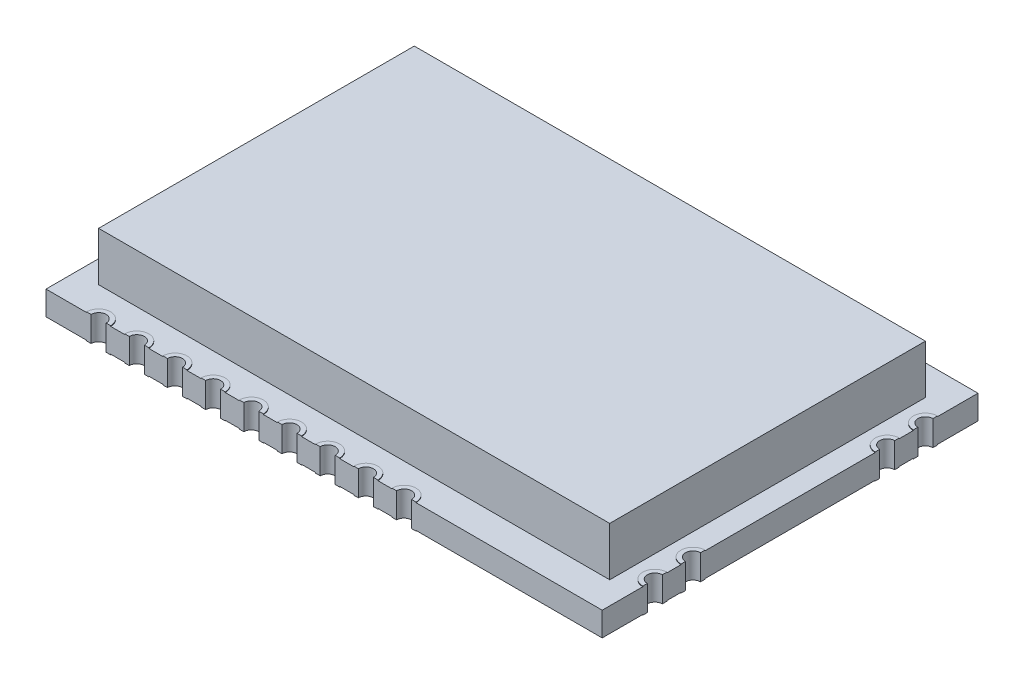
from build123d import *

# Parameters (mm, degrees)
BOSS_EXTRUDE1_DEPTH = 1.6
BOSS_EXTRUDE2_DEPTH = 0.04
BOSS_EXTRUDE3_START = 0.04
BOSS_EXTRUDE3_DEPTH = 0.04
SKETCH11_W          = 34
SKETCH11_H          = 21
BOSS_EXTRUDE5_DEPTH = 3.25


with BuildPart() as part:
    # Sketch1 → Boss-Extrude1 (new body)
    with BuildSketch(Plane(origin=(0, 0, 0), x_dir=(1, 0, 0), z_dir=(0, 1, 0))):
        with BuildLine():
            Line((18.5, 9.5), (18.5, 12.5))
            Line((18.5, 12.5), (5.82, 12.5))
            ThreePointArc((5.82, 12.5), (5.32, 12), (4.82, 12.5))
            Line((4.82, 12.5), (3.28, 12.5))
            ThreePointArc((3.28, 12.5), (2.78, 12), (2.28, 12.5))
            Line((2.28, 12.5), (0.74, 12.5))
            ThreePointArc((0.74, 12.5), (0.24, 12), (-0.26, 12.5))
            Line((-0.26, 12.5), (-1.8, 12.5))
            ThreePointArc((-1.8, 12.5), (-2.3, 12), (-2.8, 12.5))
            Line((-2.8, 12.5), (-4.34, 12.5))
            ThreePointArc((-4.34, 12.5), (-4.84, 12), (-5.34, 12.5))
            Line((-5.34, 12.5), (-6.88, 12.5))
            ThreePointArc((-6.88, 12.5), (-7.38, 12), (-7.88, 12.5))
            Line((-7.88, 12.5), (-9.42, 12.5))
            ThreePointArc((-9.42, 12.5), (-9.92, 12), (-10.42, 12.5))
            Line((-10.42, 12.5), (-11.96, 12.5))
            ThreePointArc((-11.96, 12.5), (-12.46, 12), (-12.96, 12.5))
            Line((-12.96, 12.5), (-14.5, 12.5))
            ThreePointArc((-14.5, 12.5), (-15, 12), (-15.5, 12.5))
            Line((-15.5, 12.5), (-18.5, 12.5))
            Line((-18.5, 12.5), (-18.5, -12.5))
            Line((-18.5, -12.5), (-15.5, -12.5))
            ThreePointArc((-15.5, -12.5), (-15, -12), (-14.5, -12.5))
            Line((-14.5, -12.5), (-12.96, -12.5))
            ThreePointArc((-12.96, -12.5), (-12.46, -12), (-11.96, -12.5))
            Line((-11.96, -12.5), (-10.42, -12.5))
            ThreePointArc((-10.42, -12.5), (-9.92, -12), (-9.42, -12.5))
            Line((-9.42, -12.5), (-7.88, -12.5))
            ThreePointArc((-7.88, -12.5), (-7.38, -12), (-6.88, -12.5))
            Line((-6.88, -12.5), (-5.34, -12.5))
            ThreePointArc((-5.34, -12.5), (-4.84, -12), (-4.34, -12.5))
            Line((-4.34, -12.5), (-2.8, -12.5))
            ThreePointArc((-2.8, -12.5), (-2.3, -12), (-1.8, -12.5))
            Line((-1.8, -12.5), (-0.26, -12.5))
            ThreePointArc((-0.26, -12.5), (0.24, -12), (0.74, -12.5))
            Line((0.74, -12.5), (2.28, -12.5))
            ThreePointArc((2.28, -12.5), (2.78, -12), (3.28, -12.5))
            Line((3.28, -12.5), (4.82, -12.5))
            ThreePointArc((4.82, -12.5), (5.32, -12), (5.82, -12.5))
            Line((5.82, -12.5), (18.5, -12.5))
            Line((18.5, -12.5), (18.5, -9.5))
            ThreePointArc((18.5, -9.5), (18, -9), (18.5, -8.5))
            Line((18.5, -8.5), (18.5, -6.96))
            ThreePointArc((18.5, -6.96), (18, -6.46), (18.5, -5.96))
            Line((18.5, -5.96), (18.5, 5.96))
            ThreePointArc((18.5, 5.96), (18, 6.46), (18.5, 6.96))
            Line((18.5, 6.96), (18.5, 8.5))
            ThreePointArc((18.5, 8.5), (18, 9), (18.5, 9.5))
        make_face()
    extrude(amount=BOSS_EXTRUDE1_DEPTH)

    # Sketch2 → Boss-Extrude2 (add)
    with BuildSketch(Plane(origin=(0, 1.6, 0), x_dir=(1, 0, 0), z_dir=(0, 1, 0))):
        with BuildLine():
            Line((-15.5, 12.5), (-15.8, 12.5))
            ThreePointArc((-15.8, 12.5), (-15, 11.7), (-14.2, 12.5))
            Line((-14.2, 12.5), (-14.5, 12.5))
            ThreePointArc((-14.5, 12.5), (-15, 12), (-15.5, 12.5))
        make_face()
        with BuildLine():
            Line((-13.26, 12.5), (-12.96, 12.5))
            ThreePointArc((-12.96, 12.5), (-12.46, 12), (-11.96, 12.5))
            Line((-11.96, 12.5), (-11.66, 12.5))
            ThreePointArc((-11.66, 12.5), (-12.46, 11.7), (-13.26, 12.5))
        make_face()
        with BuildLine():
            Line((5.82, 12.5), (6.12, 12.5))
            ThreePointArc((6.12, 12.5), (5.32, 11.7), (4.52, 12.5))
            Line((4.52, 12.5), (4.82, 12.5))
            ThreePointArc((4.82, 12.5), (5.32, 12), (5.82, 12.5))
        make_face()
        with BuildLine():
            Line((3.58, 12.5), (3.28, 12.5))
            ThreePointArc((3.28, 12.5), (2.78, 12), (2.28, 12.5))
            Line((2.28, 12.5), (1.98, 12.5))
            ThreePointArc((1.98, 12.5), (2.78, 11.7), (3.58, 12.5))
        make_face()
        with BuildLine():
            Line((0.74, 12.5), (1.04, 12.5))
            ThreePointArc((1.04, 12.5), (0.24, 11.7), (-0.56, 12.5))
            Line((-0.56, 12.5), (-0.26, 12.5))
            ThreePointArc((-0.26, 12.5), (0.24, 12), (0.74, 12.5))
        make_face()
        with BuildLine():
            Line((-3.1, 12.5), (-2.8, 12.5))
            ThreePointArc((-2.8, 12.5), (-2.3, 12), (-1.8, 12.5))
            Line((-1.8, 12.5), (-1.5, 12.5))
            ThreePointArc((-1.5, 12.5), (-2.3, 11.7), (-3.1, 12.5))
        make_face()
        with BuildLine():
            Line((-5.64, 12.5), (-5.34, 12.5))
            ThreePointArc((-5.34, 12.5), (-4.84, 12), (-4.34, 12.5))
            Line((-4.34, 12.5), (-4.04, 12.5))
            ThreePointArc((-4.04, 12.5), (-4.84, 11.7), (-5.64, 12.5))
        make_face()
        with BuildLine():
            Line((-6.88, 12.5), (-6.58, 12.5))
            ThreePointArc((-6.58, 12.5), (-7.38, 11.7), (-8.18, 12.5))
            Line((-8.18, 12.5), (-7.88, 12.5))
            ThreePointArc((-7.88, 12.5), (-7.38, 12), (-6.88, 12.5))
        make_face()
        with BuildLine():
            Line((-10.72, 12.5), (-10.42, 12.5))
            ThreePointArc((-10.42, 12.5), (-9.92, 12), (-9.42, 12.5))
            Line((-9.42, 12.5), (-9.12, 12.5))
            ThreePointArc((-9.12, 12.5), (-9.92, 11.7), (-10.72, 12.5))
        make_face()
        with BuildLine():
            Line((5.82, -12.5), (6.12, -12.5))
            ThreePointArc((6.12, -12.5), (5.32, -11.7), (4.52, -12.5))
            Line((4.52, -12.5), (4.82, -12.5))
            ThreePointArc((4.82, -12.5), (5.32, -12), (5.82, -12.5))
        make_face()
        with BuildLine():
            Line((3.28, -12.5), (3.58, -12.5))
            ThreePointArc((3.58, -12.5), (2.78, -11.7), (1.98, -12.5))
            Line((1.98, -12.5), (2.28, -12.5))
            ThreePointArc((2.28, -12.5), (2.78, -12), (3.28, -12.5))
        make_face()
        with BuildLine():
            Line((-0.56, -12.5), (-0.26, -12.5))
            ThreePointArc((-0.26, -12.5), (0.24, -12), (0.74, -12.5))
            Line((0.74, -12.5), (1.04, -12.5))
            ThreePointArc((1.04, -12.5), (0.24, -11.7), (-0.56, -12.5))
        make_face()
        with BuildLine():
            Line((-3.1, -12.5), (-2.8, -12.5))
            ThreePointArc((-2.8, -12.5), (-2.3, -12), (-1.8, -12.5))
            Line((-1.8, -12.5), (-1.5, -12.5))
            ThreePointArc((-1.5, -12.5), (-2.3, -11.7), (-3.1, -12.5))
        make_face()
        with BuildLine():
            Line((-5.64, -12.5), (-5.34, -12.5))
            ThreePointArc((-5.34, -12.5), (-4.84, -12), (-4.34, -12.5))
            Line((-4.34, -12.5), (-4.04, -12.5))
            ThreePointArc((-4.04, -12.5), (-4.84, -11.7), (-5.64, -12.5))
        make_face()
        with BuildLine():
            Line((-8.18, -12.5), (-7.88, -12.5))
            ThreePointArc((-7.88, -12.5), (-7.38, -12), (-6.88, -12.5))
            Line((-6.88, -12.5), (-6.58, -12.5))
            ThreePointArc((-6.58, -12.5), (-7.38, -11.7), (-8.18, -12.5))
        make_face()
        with BuildLine():
            Line((-10.72, -12.5), (-10.42, -12.5))
            ThreePointArc((-10.42, -12.5), (-9.92, -12), (-9.42, -12.5))
            Line((-9.42, -12.5), (-9.12, -12.5))
            ThreePointArc((-9.12, -12.5), (-9.92, -11.7), (-10.72, -12.5))
        make_face()
        with BuildLine():
            Line((-13.26, -12.5), (-12.96, -12.5))
            ThreePointArc((-12.96, -12.5), (-12.46, -12), (-11.96, -12.5))
            Line((-11.96, -12.5), (-11.66, -12.5))
            ThreePointArc((-11.66, -12.5), (-12.46, -11.7), (-13.26, -12.5))
        make_face()
        with BuildLine():
            Line((18.5, -8.2), (18.5, -8.5))
            ThreePointArc((18.5, -8.5), (18, -9), (18.5, -9.5))
            Line((18.5, -9.5), (18.5, -9.8))
            ThreePointArc((18.5, -9.8), (17.7, -9), (18.5, -8.2))
        make_face()
        with BuildLine():
            Line((18.5, 9.8), (18.5, 9.5))
            ThreePointArc((18.5, 9.5), (18, 9), (18.5, 8.5))
            Line((18.5, 8.5), (18.5, 8.2))
            ThreePointArc((18.5, 8.2), (17.7, 9), (18.5, 9.8))
        make_face()
        with BuildLine():
            Line((18.5, 7.26), (18.5, 6.96))
            ThreePointArc((18.5, 6.96), (18, 6.46), (18.5, 5.96))
            Line((18.5, 5.96), (18.5, 5.66))
            ThreePointArc((18.5, 5.66), (17.7, 6.46), (18.5, 7.26))
        make_face()
        with BuildLine():
            Line((18.5, -5.66), (18.5, -5.96))
            ThreePointArc((18.5, -5.96), (18, -6.46), (18.5, -6.96))
            Line((18.5, -6.96), (18.5, -7.26))
            ThreePointArc((18.5, -7.26), (17.7, -6.46), (18.5, -5.66))
        make_face()
        with BuildLine():
            Line((-15.5, -12.5), (-15.8, -12.5))
            ThreePointArc((-15.8, -12.5), (-15, -11.7), (-14.2, -12.5))
            Line((-14.2, -12.5), (-14.5, -12.5))
            ThreePointArc((-14.5, -12.5), (-15, -12), (-15.5, -12.5))
        make_face()
    extrude(amount=BOSS_EXTRUDE2_DEPTH)

    # Sketch9 → Boss-Extrude3 (add)
    with BuildSketch(Plane(origin=(0, 0, 0), x_dir=(-1, 0, 0), z_dir=(0, -1, 0)).offset(BOSS_EXTRUDE3_START)):
        with BuildLine():
            Line((15.5, 12.5), (15.8, 12.5))
            Line((15.8, 12.5), (15.8, 10.504982051))
            Line((15.8, 10.504982051), (14.2, 10.504982051))
            Line((14.2, 10.504982051), (14.2, 12.5))
            Line((14.2, 12.5), (14.5, 12.5))
            ThreePointArc((14.5, 12.5), (15, 12), (15.5, 12.5))
        make_face()
        with BuildLine():
            Line((12.96, 12.5), (13.26, 12.5))
            Line((13.26, 12.5), (13.26, 10.504982051))
            Line((13.26, 10.504982051), (11.66, 10.504982051))
            Line((11.66, 10.504982051), (11.66, 12.5))
            Line((11.66, 12.5), (11.96, 12.5))
            ThreePointArc((11.96, 12.5), (12.46, 12), (12.96, 12.5))
        make_face()
        with BuildLine():
            Line((10.42, 12.5), (10.72, 12.5))
            Line((10.72, 12.5), (10.72, 10.504982051))
            Line((10.72, 10.504982051), (9.12, 10.504982051))
            Line((9.12, 10.504982051), (9.12, 12.5))
            Line((9.12, 12.5), (9.42, 12.5))
            ThreePointArc((9.42, 12.5), (9.92, 12), (10.42, 12.5))
        make_face()
        with BuildLine():
            Line((7.88, 12.5), (8.18, 12.5))
            Line((8.18, 12.5), (8.18, 10.504982051))
            Line((8.18, 10.504982051), (6.58, 10.504982051))
            Line((6.58, 10.504982051), (6.58, 12.5))
            Line((6.58, 12.5), (6.88, 12.5))
            ThreePointArc((6.88, 12.5), (7.38, 12), (7.88, 12.5))
        make_face()
        with BuildLine():
            Line((5.34, 12.5), (5.64, 12.5))
            Line((5.64, 12.5), (5.64, 10.504982051))
            Line((5.64, 10.504982051), (4.04, 10.504982051))
            Line((4.04, 10.504982051), (4.04, 12.5))
            Line((4.04, 12.5), (4.34, 12.5))
            ThreePointArc((4.34, 12.5), (4.84, 12), (5.34, 12.5))
        make_face()
        with BuildLine():
            Line((2.8, 12.5), (3.1, 12.5))
            Line((3.1, 12.5), (3.1, 10.504982051))
            Line((3.1, 10.504982051), (1.5, 10.504982051))
            Line((1.5, 10.504982051), (1.5, 12.5))
            Line((1.5, 12.5), (1.8, 12.5))
            ThreePointArc((1.8, 12.5), (2.3, 12), (2.8, 12.5))
        make_face()
        with BuildLine():
            Line((0.26, 12.5), (0.56, 12.5))
            Line((0.56, 12.5), (0.56, 10.504982051))
            Line((0.56, 10.504982051), (-1.04, 10.504982051))
            Line((-1.04, 10.504982051), (-1.04, 12.5))
            Line((-1.04, 12.5), (-0.74, 12.5))
            ThreePointArc((-0.74, 12.5), (-0.24, 12), (0.26, 12.5))
        make_face()
        with BuildLine():
            Line((-2.28, 12.5), (-1.98, 12.5))
            Line((-1.98, 12.5), (-1.98, 10.504982051))
            Line((-1.98, 10.504982051), (-3.58, 10.504982051))
            Line((-3.58, 10.504982051), (-3.58, 12.5))
            Line((-3.58, 12.5), (-3.28, 12.5))
            ThreePointArc((-3.28, 12.5), (-2.78, 12), (-2.28, 12.5))
        make_face()
        with BuildLine():
            Line((-4.82, 12.5), (-4.52, 12.5))
            Line((-4.52, 12.5), (-4.52, 10.504982051))
            Line((-4.52, 10.504982051), (-6.12, 10.504982051))
            Line((-6.12, 10.504982051), (-6.12, 12.5))
            Line((-6.12, 12.5), (-5.82, 12.5))
            ThreePointArc((-5.82, 12.5), (-5.32, 12), (-4.82, 12.5))
        make_face()
        with BuildLine():
            Line((15.8, -12.5), (15.8, -10.5))
            Line((15.8, -10.5), (14.2, -10.5))
            Line((14.2, -10.5), (14.2, -12.5))
            Line((14.2, -12.5), (14.5, -12.5))
            ThreePointArc((14.5, -12.5), (15, -12), (15.5, -12.5))
            Line((15.5, -12.5), (15.8, -12.5))
        make_face()
        with BuildLine():
            Line((12.96, -12.5), (13.26, -12.5))
            Line((13.26, -12.5), (13.26, -10.5))
            Line((13.26, -10.5), (11.66, -10.5))
            Line((11.66, -10.5), (11.66, -12.5))
            Line((11.66, -12.5), (11.96, -12.5))
            ThreePointArc((11.96, -12.5), (12.46, -12), (12.96, -12.5))
        make_face()
        with BuildLine():
            Line((10.42, -12.5), (10.72, -12.5))
            Line((10.72, -12.5), (10.72, -10.5))
            Line((10.72, -10.5), (9.12, -10.5))
            Line((9.12, -10.5), (9.12, -12.5))
            Line((9.12, -12.5), (9.42, -12.5))
            ThreePointArc((9.42, -12.5), (9.92, -12), (10.42, -12.5))
        make_face()
        with BuildLine():
            Line((7.88, -12.5), (8.18, -12.5))
            Line((8.18, -12.5), (8.18, -10.5))
            Line((8.18, -10.5), (6.581935212, -10.5))
            Line((6.581935212, -10.5), (6.58, -12.5))
            Line((6.58, -12.5), (6.88, -12.5))
            ThreePointArc((6.88, -12.5), (7.38, -12), (7.88, -12.5))
        make_face()
        with BuildLine():
            Line((5.34, -12.5), (5.64, -12.5))
            Line((5.64, -12.5), (5.64, -10.5))
            Line((5.64, -10.5), (4.04, -10.5))
            Line((4.04, -10.5), (4.04, -12.5))
            Line((4.04, -12.5), (4.34, -12.5))
            ThreePointArc((4.34, -12.5), (4.84, -12), (5.34, -12.5))
        make_face()
        with BuildLine():
            Line((2.8, -12.5), (3.1, -12.5))
            Line((3.1, -12.5), (3.1, -10.5))
            Line((3.1, -10.5), (1.5, -10.5))
            Line((1.5, -10.5), (1.5, -12.5))
            Line((1.5, -12.5), (1.8, -12.5))
            ThreePointArc((1.8, -12.5), (2.3, -12), (2.8, -12.5))
        make_face()
        with BuildLine():
            Line((0.26, -12.5), (0.56, -12.5))
            Line((0.56, -12.5), (0.56, -10.5))
            Line((0.56, -10.5), (-1.04, -10.5))
            Line((-1.04, -10.5), (-1.04, -12.5))
            Line((-1.04, -12.5), (-0.74, -12.5))
            ThreePointArc((-0.74, -12.5), (-0.24, -12), (0.26, -12.5))
        make_face()
        with BuildLine():
            Line((-2.28, -12.5), (-1.98, -12.5))
            Line((-1.98, -12.5), (-1.98, -10.5))
            Line((-1.98, -10.5), (-3.58, -10.5))
            Line((-3.58, -10.5), (-3.58, -12.5))
            Line((-3.58, -12.5), (-3.28, -12.5))
            ThreePointArc((-3.28, -12.5), (-2.78, -12), (-2.28, -12.5))
        make_face()
        with BuildLine():
            Line((-4.82, -12.5), (-4.52, -12.5))
            Line((-4.52, -12.5), (-4.52, -10.5))
            Line((-4.52, -10.5), (-6.066456982, -10.5))
            Line((-6.066456982, -10.5), (-6.12, -12.5))
            Line((-6.12, -12.5), (-5.82, -12.5))
            ThreePointArc((-5.82, -12.5), (-5.32, -12), (-4.82, -12.5))
        make_face()
        with BuildLine():
            Line((-18.5, 9.5), (-18.5, 9.8))
            Line((-18.5, 9.8), (-16.5, 9.8))
            Line((-16.5, 9.8), (-16.5, 8.2))
            Line((-16.5, 8.2), (-18.5, 8.2))
            Line((-18.5, 8.2), (-18.5, 8.5))
            ThreePointArc((-18.5, 8.5), (-18, 9), (-18.5, 9.5))
        make_face()
        with BuildLine():
            Line((-18.5, 6.96), (-18.5, 7.26))
            Line((-18.5, 7.26), (-16.5, 7.26))
            Line((-16.5, 7.26), (-16.5, 5.66))
            Line((-16.5, 5.66), (-18.5, 5.66))
            Line((-18.5, 5.66), (-18.5, 5.96))
            ThreePointArc((-18.5, 5.96), (-18, 6.46), (-18.5, 6.96))
        make_face()
        with BuildLine():
            Line((-18.5, -5.96), (-18.5, -5.66))
            Line((-18.5, -5.66), (-16.5, -5.66))
            Line((-16.5, -5.66), (-16.5, -7.26))
            Line((-16.5, -7.26), (-18.5, -7.26))
            Line((-18.5, -7.26), (-18.5, -6.96))
            ThreePointArc((-18.5, -6.96), (-18, -6.46), (-18.5, -5.96))
        make_face()
        with BuildLine():
            Line((-18.5, -8.5), (-18.5, -8.2))
            Line((-18.5, -8.2), (-16.5, -8.2))
            Line((-16.5, -8.2), (-16.5, -9.8))
            Line((-16.5, -9.8), (-18.5, -9.8))
            Line((-18.5, -9.8), (-18.5, -9.5))
            ThreePointArc((-18.5, -9.5), (-18, -9), (-18.5, -8.5))
        make_face()
    extrude(amount=-BOSS_EXTRUDE3_DEPTH)

    # Sketch11 → Boss-Extrude5 (add)
    with BuildSketch(Plane(origin=(0, 1.6, 0), x_dir=(1, 0, 0), z_dir=(0, 1, 0))):
        Rectangle(SKETCH11_W, SKETCH11_H)
    extrude(amount=BOSS_EXTRUDE5_DEPTH)


solid = part.part
